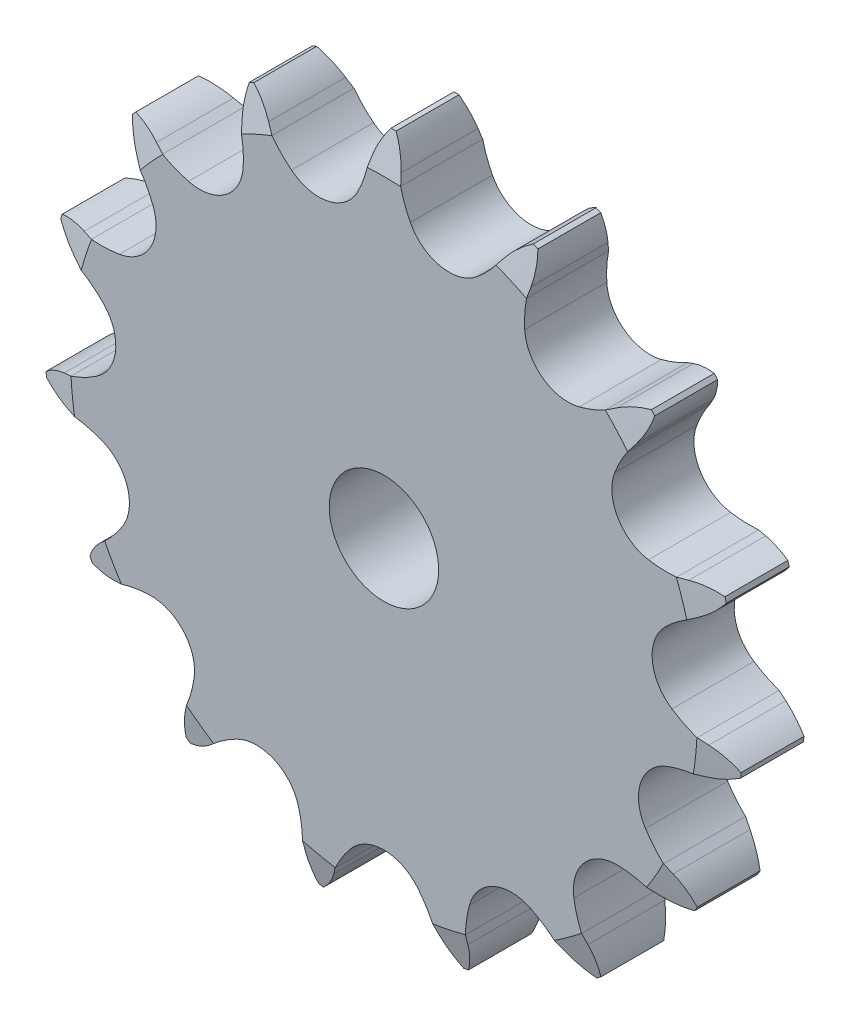
from build123d import *

# Parameters (mm, degrees)
SKETCH3_W          = 6
SKETCH3_H          = 21.527
CUT_EXTRUDE4_DEPTH = 37.225066708
CIRPATTERN2_COUNT  = 15
SKETCH5_OUTSIDE_W  = 347.184
SKETCH5_OUTSIDE_H  = 346.906
SKETCH5_OUTSIDE_R  = 22.906359817
CUT_EXTRUDE5_DEPTH = 37.511357447
CUT_EXTRUDE5_DRAFT = -75
SKETCH6_OUTSIDE_W  = 347.184
SKETCH6_OUTSIDE_H  = 346.906
SKETCH6_OUTSIDE_R  = 22.906359817
CUT_EXTRUDE6_DEPTH = 37.511357603
CUT_EXTRUDE6_DRAFT = -75


with BuildPart() as part:
    # Sketch3 → Revolve5 (revolve)
    with BuildSketch(Plane(origin=(0, 0, 0), x_dir=(0, 0, -1), z_dir=(1, 0, 0))):
        with Locations((0, 14.7635)):
            Rectangle(SKETCH3_W, SKETCH3_H)
    revolve(axis=Axis((0, 0, 3), (0, 0, -1)))

    # Sketch4 → Cut-Extrude4 (cut, symmetric)
    with BuildSketch(Plane.XY):
        with BuildLine():
            Line((1.219884983, 22.88872777), (1.063923116, 23.578912677))
            ThreePointArc((1.063923116, 23.578912677), (0.65856297, 24.734033373), (0, 25.765980797))
            ThreePointArc((0, 25.765980797), (5.974327611, 28.107001564), (10.479968535, 23.538394719))
            ThreePointArc((10.479968535, 23.538394719), (9.458610494, 22.863525529), (8.61846566, 21.973145089))
            Line((8.61846566, 21.973145089), (8.195263912, 21.406065208))
            ThreePointArc((8.195263912, 21.406065208), (7.524676999, 20.626400483), (6.762535268, 19.935963031))
            ThreePointArc((6.762535268, 19.935963031), (4.101738454, 19.297162233), (1.930803303, 20.962979364))
            ThreePointArc((1.930803303, 20.962979364), (1.515378398, 21.903716331), (1.219884983, 22.88872777))
        make_face()
    cut_extrude4 = extrude(amount=CUT_EXTRUDE4_DEPTH, both=True, mode=Mode.SUBTRACT)

    # CirPattern2: Cut-Extrude4 ×15 about axis
    cirpattern2_axis = Axis((0, 0, 3), (0, 0, -1))
    for i in range(1, CIRPATTERN2_COUNT):
        add(cut_extrude4.rotate(cirpattern2_axis, i * 360 / CIRPATTERN2_COUNT), mode=Mode.SUBTRACT)


with BuildPart() as cut_extrude5_tool:
    # Sketch5 outside → Cut-Extrude5 (with draft: the straight prism first)
    with BuildSketch(Plane.XY.offset(3)):
        with Locations((0, 0.26)):
            Rectangle(SKETCH5_OUTSIDE_W, SKETCH5_OUTSIDE_H)
        Circle(SKETCH5_OUTSIDE_R, mode=Mode.SUBTRACT)
    extrude(amount=-CUT_EXTRUDE5_DEPTH)
    # Cut-Extrude5: the draft: its side faces are tilted about the plane it starts from
    cut_extrude5_sides = [cut_extrude5_tool.faces().sort_by_distance(p)[0] for p in [
        (0, -173.193, -15.755678724),
        (173.592, 0.26, -15.755678724),
        (0, 173.713, -15.755678724),
        (-173.592, 0.26, -15.755678724),
        (-22.906359817, 0, -15.755678724),
    ]]
    draft(cut_extrude5_sides, Plane.XY.offset(3), CUT_EXTRUDE5_DRAFT)


with BuildPart() as part_1:
    add(part.part)

    # Cut-Extrude5: cut by cut_extrude5_tool
    add(cut_extrude5_tool.part, mode=Mode.SUBTRACT)


with BuildPart() as cut_extrude6_tool:
    # Sketch6 outside → Cut-Extrude6 (with draft: the straight prism first)
    with BuildSketch(Plane(origin=(0, 0, -3), x_dir=(-1, 0, 0), z_dir=(0, 0, -1))):
        with Locations((0, 0.26)):
            Rectangle(SKETCH6_OUTSIDE_W, SKETCH6_OUTSIDE_H)
        Circle(SKETCH6_OUTSIDE_R, mode=Mode.SUBTRACT)
    extrude(amount=-CUT_EXTRUDE6_DEPTH)
    # Cut-Extrude6: the draft: its side faces are tilted about the plane it starts from
    cut_extrude6_sides = [cut_extrude6_tool.faces().sort_by_distance(p)[0] for p in [
        (0, -173.193, 15.755678802),
        (-173.592, 0.26, 15.755678802),
        (0, 173.713, 15.755678802),
        (173.592, 0.26, 15.755678802),
        (22.906359817, 0, 15.755678802),
    ]]
    draft(cut_extrude6_sides, Plane(origin=(0, 0, -3), x_dir=(-1, 0, 0), z_dir=(0, 0, -1)), CUT_EXTRUDE6_DRAFT)


with BuildPart() as part_2:
    add(part_1.part)

    # Cut-Extrude6: cut by cut_extrude6_tool
    add(cut_extrude6_tool.part, mode=Mode.SUBTRACT)


solid = part_2.part
